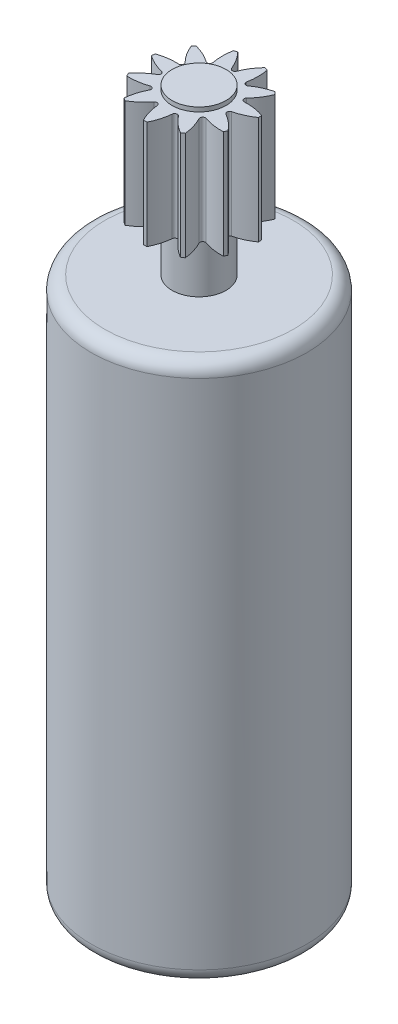
from build123d import *

# Parameters (mm, degrees)
RADYUS1_R               = 0.5
KES_EKSTR_ZYON1_START   = -4
KES_EKSTR_ZYON1_DEPTH   = 4
DAIRESEL_KAPLAMA1_COUNT = 11


with BuildPart() as part:
    # Çizim1 → Döndür1 (revolve)
    with BuildSketch(Plane.XY, mode=Mode.PRIVATE) as d_nd_r1_sk:
        Polygon((0, 0), (0, 26.1), (1, 26.1), (1, 25.939294597), (2, 25.939294597), (2, 21.939294597), (1, 21.939294597), (1, 20), (4, 20), (4, 0), align=None)
    revolve(d_nd_r1_sk.sketch.rotate(Axis((0, 0, 0), (0, 1, 0)), 90), axis=Axis((0, 0, 0), (0, 1, 0)))

    # Radyus1
    radyus1_edges = [part.edges().sort_by_distance(p)[0] for p in [
        (0, 0, 4),
        (0, 20, 4),
    ]]
    fillet(radyus1_edges, radius=RADYUS1_R)

    # Çizim2 → Kes-Ekstrüzyon1 (cut)
    with BuildSketch(Plane(origin=(0, 25.939294597, 0), x_dir=(1, 0, 0), z_dir=(0, 1, 0)).offset(KES_EKSTR_ZYON1_START)):
        with BuildLine():
            ThreePointArc((0.5, 1.936491673), (0, 2), (-0.5, 1.936491673))
            ThreePointArc((-0.5, 1.936491673), (-0.266031544, 1.636956648), (-0.092954447, 1.298568131))
            ThreePointArc((-0.092954447, 1.298568131), (0, 1.235439134), (0.092954447, 1.298568131))
            ThreePointArc((0.092954447, 1.298568131), (0.266031544, 1.636956648), (0.5, 1.936491673))
        make_face()
    kes_ekstr_zyon1 = extrude(amount=KES_EKSTR_ZYON1_DEPTH, mode=Mode.SUBTRACT)

    # Dairesel Kaplama1: Kes-Ekstrüzyon1 ×11 about axis
    dairesel_kaplama1_axis = Axis((0, 0, 0), (0, 1, 0))
    for i in range(1, DAIRESEL_KAPLAMA1_COUNT):
        add(kes_ekstr_zyon1.rotate(dairesel_kaplama1_axis, i * 360 / DAIRESEL_KAPLAMA1_COUNT), mode=Mode.SUBTRACT)


solid = part.part
